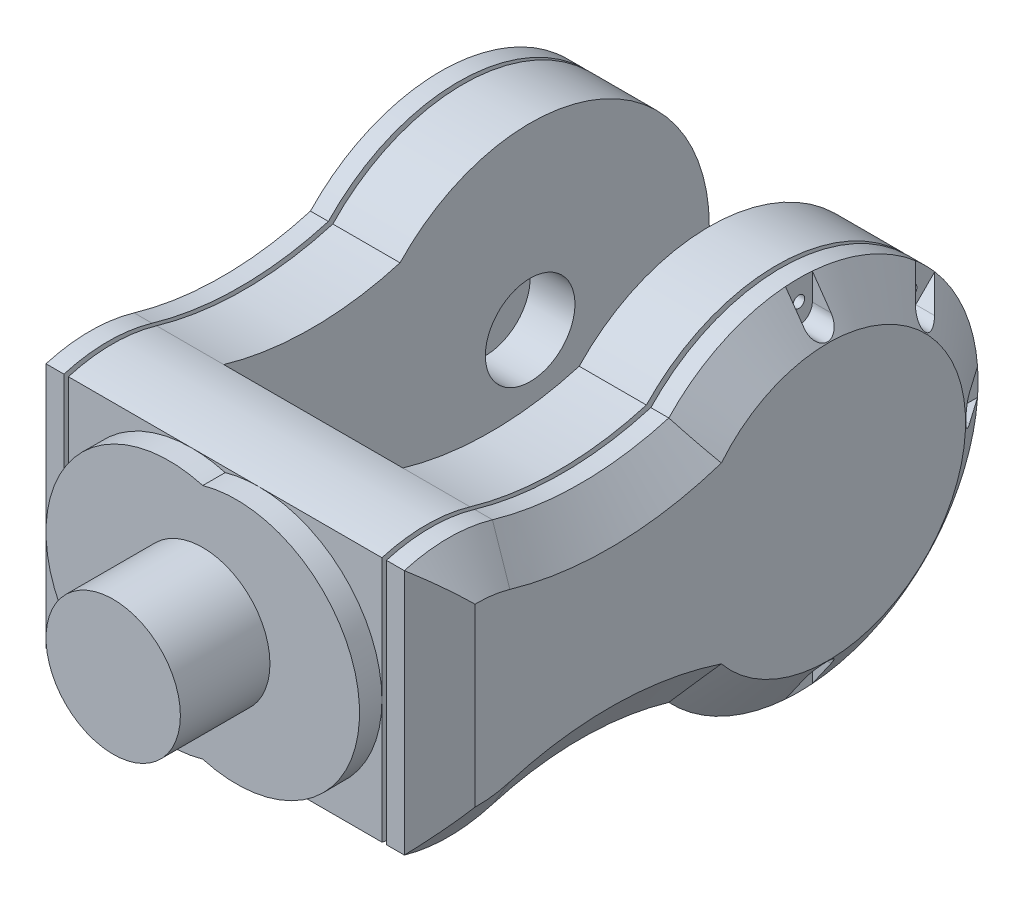
from build123d import *

# Parameters (mm, degrees)
IZIM2_R                               = 27.5
Y_KSEKLIK_EKSTR_ZYON1_DEPTH           = 5
Y_KSEKLIK_EKSTR_ZYON2_DEPTH           = 15
Y_KSEKLIK_EKSTR_ZYON3_DEPTH           = 1
Y_KSEKLIK_EKSTR_ZYON4_DEPTH           = 4
Y_KSEKLIK_EKSTR_ZYON5_DEPTH           = 6.5
Y_KSEKLIK_EKSTR_ZYON5_DRAFT           = 55
KES_EKSTR_ZYON1_DEPTH                 = 6.5
IZIM8_R                               = 1.288694964
KES_EKSTR_ZYON2_DEPTH                 = 5
DAIRESEL_KAPLAMA1_COUNT               = 3
DAIRESEL_KAPLAMA1_ANGLE               = 90
DAIRESEL_KAPLAMA1_THE_OTHER_WAY_COUNT = 3
DAIRESEL_KAPLAMA1_THE_OTHER_WAY_ANGLE = 90
Y_KSEKLIK_EKSTR_ZYON6_DEPTH           = 40
IZIM11_R                              = 15
Y_KSEKLIK_EKSTR_ZYON7_DEPTH           = 20
IZIM14_R                              = 10
KES_EKSTR_ZYON4_DEPTH                 = 10


with BuildPart() as part:
    # Çizim2 → Yükseklik-Ekstrüzyon1 (new body)
    with BuildSketch(Plane.XY):
        Circle(IZIM2_R)
    extrude(amount=Y_KSEKLIK_EKSTR_ZYON1_DEPTH)



with BuildPart() as body_2:
    # Çizim3 → Yükseklik-Ekstrüzyon2 (new body)
    with BuildSketch(Plane(origin=(27.5, 0, 0), x_dir=(0, 0, -1), z_dir=(1, 0, 0))):
        with BuildLine():
            Line((0, 27.5), (0, -27.5))
            ThreePointArc((0, -27.5), (9.840507473, -28.911841184), (19.681014947, -27.5))
            ThreePointArc((19.681014947, -27.5), (39.362029894, -24.676317632), (59.043044841, -27.5))
            ThreePointArc((59.043044841, -27.5), (128.090419937, 0), (59.043044841, 27.5))
            ThreePointArc((59.043044841, 27.5), (39.362029894, 24.676317632), (19.681014947, 27.5))
            ThreePointArc((19.681014947, 27.5), (9.840507473, 28.911841184), (0, 27.5))
        make_face()
    extrude(amount=Y_KSEKLIK_EKSTR_ZYON2_DEPTH)

    # Çizim4 → Yükseklik-Ekstrüzyon3 (add)
    with BuildSketch(Plane(origin=(42.5, 0, 0), x_dir=(0, 0, -1), z_dir=(1, 0, 0))):
        with BuildLine():
            Line((2.5, 25.572020432), (2.5, -25.572020432))
            ThreePointArc((2.5, -25.572020432), (10.769431273, -26.398563096), (18.978121556, -25.100845799))
            ThreePointArc((18.978121556, -25.100845799), (39.708342917, -22.177144759), (60.409687118, -25.298755515))
            ThreePointArc((60.409687118, -25.298755515), (125.590419937, 0), (60.409687118, 25.298755515))
            ThreePointArc((60.409687118, 25.298755515), (39.708342917, 22.177144759), (18.978121556, 25.100845799))
            ThreePointArc((18.978121556, 25.100845799), (10.769431273, 26.398563096), (2.5, 25.572020432))
        make_face()
    extrude(amount=Y_KSEKLIK_EKSTR_ZYON3_DEPTH)

    # Çizim5 → Yükseklik-Ekstrüzyon4 (add)
    with BuildSketch(Plane(origin=(43.5, 0, 0), x_dir=(0, 0, -1), z_dir=(1, 0, 0))):
        with BuildLine():
            Line((0, 27.5), (0, -27.5))
            ThreePointArc((0, -27.5), (9.840507473, -28.911841184), (19.681014947, -27.5))
            ThreePointArc((19.681014947, -27.5), (39.362029894, -24.676317632), (59.043044841, -27.5))
            ThreePointArc((59.043044841, -27.5), (128.090419937, 0), (59.043044841, 27.5))
            ThreePointArc((59.043044841, 27.5), (39.362029894, 24.676317632), (19.681014947, 27.5))
            ThreePointArc((19.681014947, 27.5), (9.840507473, 28.911841184), (0, 27.5))
        make_face()
    extrude(amount=Y_KSEKLIK_EKSTR_ZYON4_DEPTH)


with BuildPart() as y_kseklik_ekstr_zyon5_tool:
    # Çizim6 → Yükseklik-Ekstrüzyon5 (with draft: the straight prism first)
    with BuildSketch(Plane(origin=(47.5, 0, 0), x_dir=(0, 0, -1), z_dir=(1, 0, 0))):
        with BuildLine():
            Line((0, 27.5), (0, -27.5))
            ThreePointArc((0, -27.5), (9.840507473, -28.911841184), (19.681014947, -27.5))
            ThreePointArc((19.681014947, -27.5), (39.362029894, -24.676317632), (59.043044841, -27.5))
            ThreePointArc((59.043044841, -27.5), (128.090419937, 0), (59.043044841, 27.5))
            ThreePointArc((59.043044841, 27.5), (39.362029894, 24.676317632), (19.681014947, 27.5))
            ThreePointArc((19.681014947, 27.5), (9.840507473, 28.911841184), (0, 27.5))
        make_face()
    extrude(amount=Y_KSEKLIK_EKSTR_ZYON5_DEPTH)
    # Yükseklik-Ekstrüzyon5: the draft: its side faces are tilted about the plane it starts from
    y_kseklik_ekstr_zyon5_sides = [y_kseklik_ekstr_zyon5_tool.faces().sort_by_distance(p)[0] for p in [
        (50.75, 28.911841184, -9.840507473),
        (50.75, 0, 0),
        (50.75, -28.911841184, -9.840507473),
        (50.75, -24.676317632, -39.362029894),
        (50.75, 0, -128.090419937),
        (50.75, 24.676317632, -39.362029894),
    ]]
    draft(y_kseklik_ekstr_zyon5_sides, Plane(origin=(47.5, 0, 0), x_dir=(0, 0, -1), z_dir=(1, 0, 0)), Y_KSEKLIK_EKSTR_ZYON5_DRAFT)


with BuildPart() as body_2_1:
    add(body_2.part)

    # Yükseklik-Ekstrüzyon5: add y_kseklik_ekstr_zyon5_tool
    add(y_kseklik_ekstr_zyon5_tool.part)

    # Çizim7 → Kes-Ekstrüzyon1 (cut)
    with BuildSketch(Plane(origin=(54, 0, 0), x_dir=(0, 0, -1), z_dir=(1, 0, 0))):
        with BuildLine():
            Line((127.977761288, 3), (121.977761288, 3))
            ThreePointArc((121.977761288, 3), (118.977761288, 0), (121.977761288, -3))
            Line((121.977761288, -3), (127.977761288, -3))
            ThreePointArc((127.977761288, -3), (128.977761288, 0), (127.977761288, 3))
        make_face()
    kes_ekstr_zyon1 = extrude(amount=-KES_EKSTR_ZYON1_DEPTH, mode=Mode.SUBTRACT)

    # Çizim8 → Kes-Ekstrüzyon2 (cut)
    with BuildSketch(Plane(origin=(47.5, 0, 0), x_dir=(0, 0, -1), z_dir=(1, 0, 0))):
        with Locations((123.534090612, 0)):
            Circle(IZIM8_R)
    kes_ekstr_zyon2 = extrude(amount=-KES_EKSTR_ZYON2_DEPTH, mode=Mode.SUBTRACT)

    # Dairesel Kaplama1: Kes-Ekstrüzyon1, Kes-Ekstrüzyon2 ×3 about axis
    dairesel_kaplama1_axis = Axis((0, 0, -88.090419937), (1, 0, 0))
    add([kes_ekstr_zyon1.rotate(dairesel_kaplama1_axis, i * DAIRESEL_KAPLAMA1_ANGLE / (DAIRESEL_KAPLAMA1_COUNT - 1)) for i in range(1, DAIRESEL_KAPLAMA1_COUNT)], mode=Mode.SUBTRACT)
    add([kes_ekstr_zyon2.rotate(dairesel_kaplama1_axis, i * DAIRESEL_KAPLAMA1_ANGLE / (DAIRESEL_KAPLAMA1_COUNT - 1)) for i in range(1, DAIRESEL_KAPLAMA1_COUNT)], mode=Mode.SUBTRACT)

    # Dairesel Kaplama1 the other way: Kes-Ekstrüzyon1, Kes-Ekstrüzyon2 ×3 about axis
    dairesel_kaplama1_the_other_way_axis = Axis((0, 0, -88.090419937), (-1, 0, 0))
    add([kes_ekstr_zyon1.rotate(dairesel_kaplama1_the_other_way_axis, i * DAIRESEL_KAPLAMA1_THE_OTHER_WAY_ANGLE / (DAIRESEL_KAPLAMA1_THE_OTHER_WAY_COUNT - 1)) for i in range(1, DAIRESEL_KAPLAMA1_THE_OTHER_WAY_COUNT)], mode=Mode.SUBTRACT)
    add([kes_ekstr_zyon2.rotate(dairesel_kaplama1_the_other_way_axis, i * DAIRESEL_KAPLAMA1_THE_OTHER_WAY_ANGLE / (DAIRESEL_KAPLAMA1_THE_OTHER_WAY_COUNT - 1)) for i in range(1, DAIRESEL_KAPLAMA1_THE_OTHER_WAY_COUNT)], mode=Mode.SUBTRACT)


with BuildPart() as part_1:
    add(part.part)

    add(body_2_1.part)  # Yükseklik-Ekstrüzyon6 merges body 2
    # Çizim9 → Yükseklik-Ekstrüzyon6 (add)
    with BuildSketch(Plane.ZY.offset(-27.5)):
        with BuildLine():
            Line((-19.681014947, 27.5), (-19.681014947, -27.5))
            ThreePointArc((-19.681014947, -27.5), (-9.840507473, -28.911841184), (0, -27.5))
            Line((0, -27.5), (0, 27.5))
            ThreePointArc((0, 27.5), (-9.840507473, 28.911841184), (-19.681014947, 27.5))
        make_face()
    extrude(amount=Y_KSEKLIK_EKSTR_ZYON6_DEPTH)

    # Aynalama1: part across plane


with BuildPart() as part_2:
    add(part_1.part)
    add(part_1.part.mirror(Plane.ZY.offset(-7.5)))

    # Çizim11 → Yükseklik-Ekstrüzyon7 (add)
    with BuildSketch(Plane.XY.offset(5)):
        with Locations((7.5, -0.521243445)):
            Circle(IZIM11_R)
    extrude(amount=Y_KSEKLIK_EKSTR_ZYON7_DEPTH)

    # Çizim14 → Kes-Ekstrüzyon4 (cut)
    with BuildSketch(Plane.ZY.offset(-27.5)):
        with Locations((-88.090419937, 0)):
            Circle(IZIM14_R)
    kes_ekstr_zyon4 = extrude(amount=-KES_EKSTR_ZYON4_DEPTH, mode=Mode.SUBTRACT)

    # Aynalama2: Kes-Ekstrüzyon4 across plane
    add(kes_ekstr_zyon4.mirror(Plane.ZY.offset(-7.5)), mode=Mode.SUBTRACT)


solid = part_2.part
